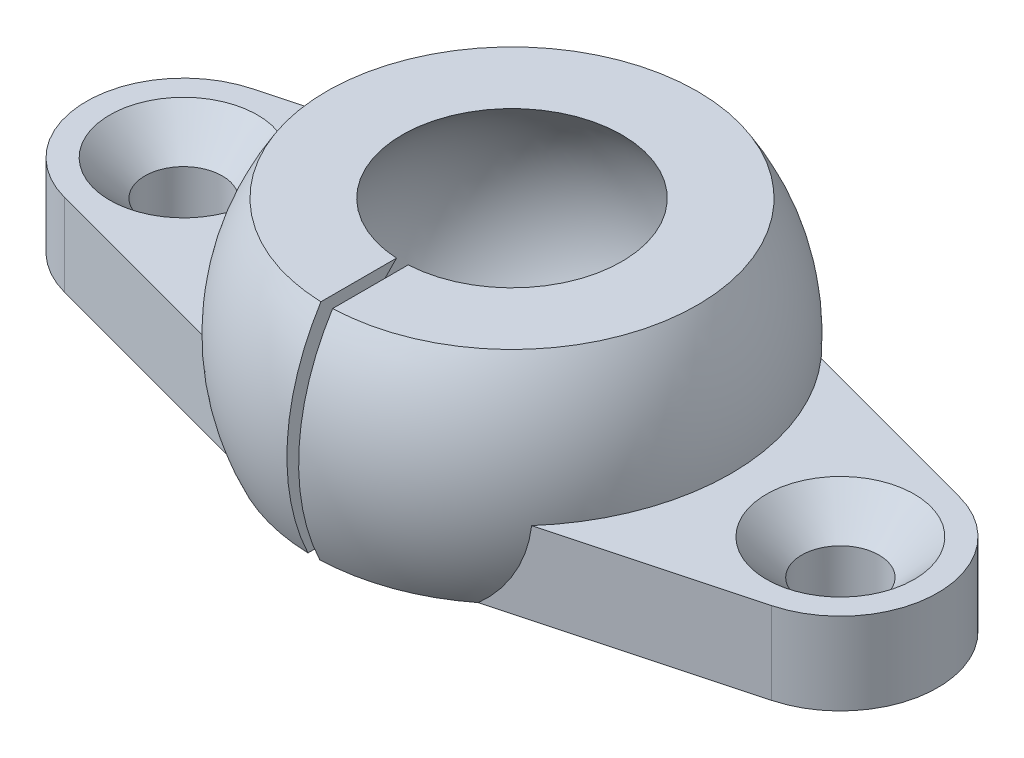
from build123d import *

# Parameters (mm, degrees)
ESQUISSE3_R                          = 1.65
BOSS_EXTRU_1_DEPTH                   = 3.5
CHANFREIN1_SIZE                      = 1.5
ENL_V_DE_MAT_EXTRU_MINCE1_DEPTH      = 23.312440476
ENL_V_DE_MAT_EXTRU_MINCE1_DEPTH_BACK = 23.312440476
ESQUISSE4_W                          = 0.5
ESQUISSE4_H                          = 9.35


with BuildPart() as part:
    # Esquisse1 → Révolution1 (revolve)
    with BuildSketch(Plane.XY):
        with BuildLine():
            Line((-5.85, -3.563705936), (-6.566198339, -4))
            Line((-6.566198339, -4), (-8.451183349, -4))
            ThreePointArc((-8.451183349, -4), (-9.332564872, 0.570730153), (-7.9007911, 5))
            Line((-7.9007911, 5), (-4.682146943, 5))
            ThreePointArc((-4.682146943, 5), (-6.787178696, 0.925583789), (-5.85, -3.563705936))
        make_face()
    revolve(axis=Axis((0, 11.493598295, 0), (0, -1, 0)))

    # Esquisse3 → Boss.-Extru.1 (add)
    # profile 1 of 2: a face of its own
    with BuildSketch(Plane.XZ.offset(4)):
        with BuildLine():
            Line((-15.074099037, 4.008592179), (-3.376482998, 7.14295895))
            ThreePointArc((-3.376482998, 7.14295895), (-7.9007911, 0), (-3.376482998, -7.14295895))
            Line((-3.376482998, -7.14295895), (-15.074099037, -4.008592179))
            ThreePointArc((-15.074099037, -4.008592179), (-18.15, 0), (-15.074099037, 4.008592179))
        make_face()
        with Locations((-14, 0)):
            Circle(ESQUISSE3_R, mode=Mode.SUBTRACT)
    # profile 2 of 2: a face of its own
    with BuildSketch(Plane.XZ.offset(4)):
        with BuildLine():
            Line((15.074099037, 4.008592179), (3.376482998, 7.14295895))
            ThreePointArc((3.376482998, 7.14295895), (7.9007911, 0), (3.376482998, -7.14295895))
            Line((3.376482998, -7.14295895), (15.074099037, -4.008592179))
            ThreePointArc((15.074099037, -4.008592179), (18.15, 0), (15.074099037, 4.008592179))
        make_face()
        with Locations((14, 0)):
            Circle(ESQUISSE3_R, mode=Mode.SUBTRACT)
    extrude(amount=-BOSS_EXTRU_1_DEPTH)

    # Chanfrein1
    chanfrein1_edges = [part.edges().sort_by_distance(p)[0] for p in [
        (-15.65, -0.5, 0),
        (12.35, -0.5, 0),
    ]]
    chamfer(chanfrein1_edges, length=CHANFREIN1_SIZE)

    # Esquisse4 → Enlèv. de mat.-Extru.-Mince1 (cut, two sides: drawn at the far end of the back side and taken through both)
    with BuildSketch(Plane(origin=(0, 5, 0), x_dir=(1, 0, 0), z_dir=(0, 1, 0)).offset(-ENL_V_DE_MAT_EXTRU_MINCE1_DEPTH_BACK)):
        with Locations((0, -4.675)):
            Rectangle(ESQUISSE4_W, ESQUISSE4_H)
    extrude(amount=ENL_V_DE_MAT_EXTRU_MINCE1_DEPTH + ENL_V_DE_MAT_EXTRU_MINCE1_DEPTH_BACK, mode=Mode.SUBTRACT)


solid = part.part
